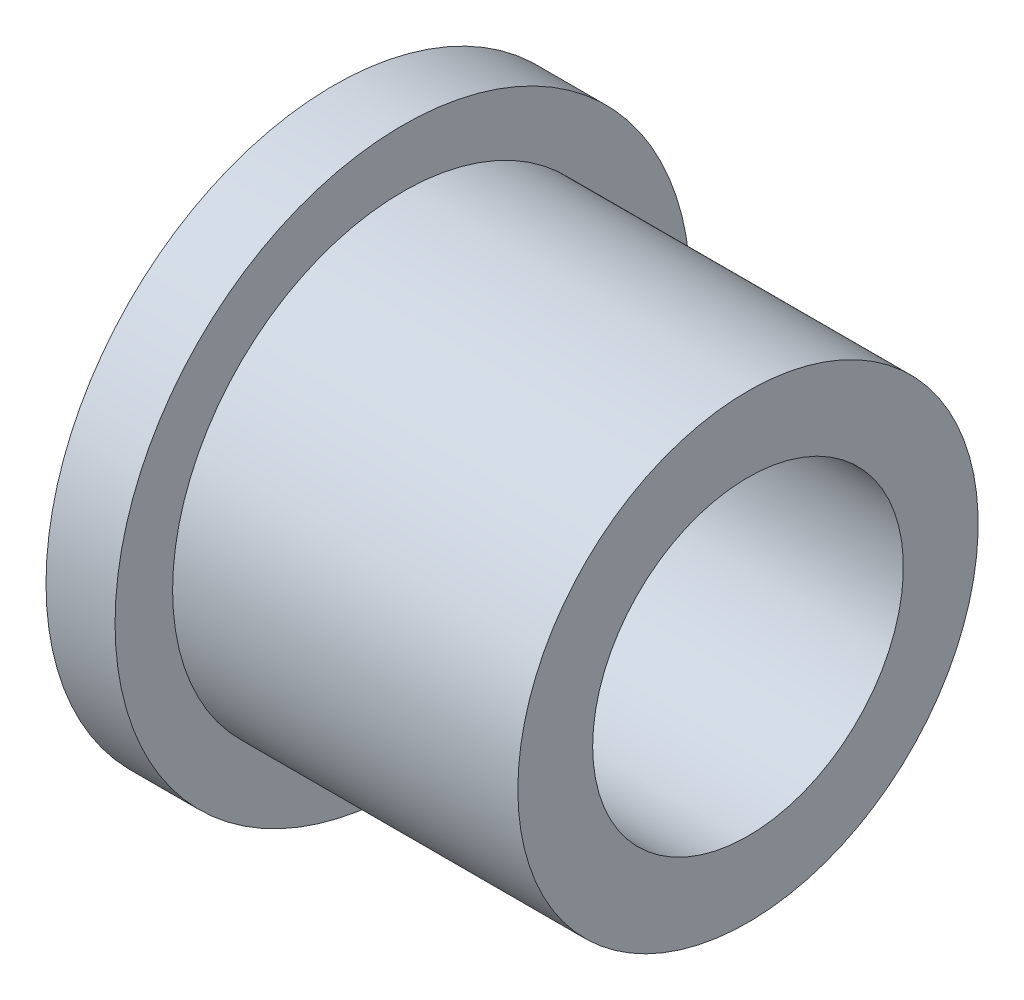
from build123d import *


with BuildPart() as part:
    # Sketch1 → Revolve1 (revolve)
    with BuildSketch(Plane.XY, mode=Mode.PRIVATE) as revolve1_sk:
        Polygon((0, 8.5725), (0, 12.7), (-19.05, 12.7), (-19.05, 15.875), (-22.86, 15.875), (-22.86, 8.5725), align=None)
    revolve(revolve1_sk.sketch.rotate(Axis((-30.377027027, 0, 0), (1, 0, 0)), 90), axis=Axis((-30.377027027, 0, 0), (1, 0, 0)))


solid = part.part
